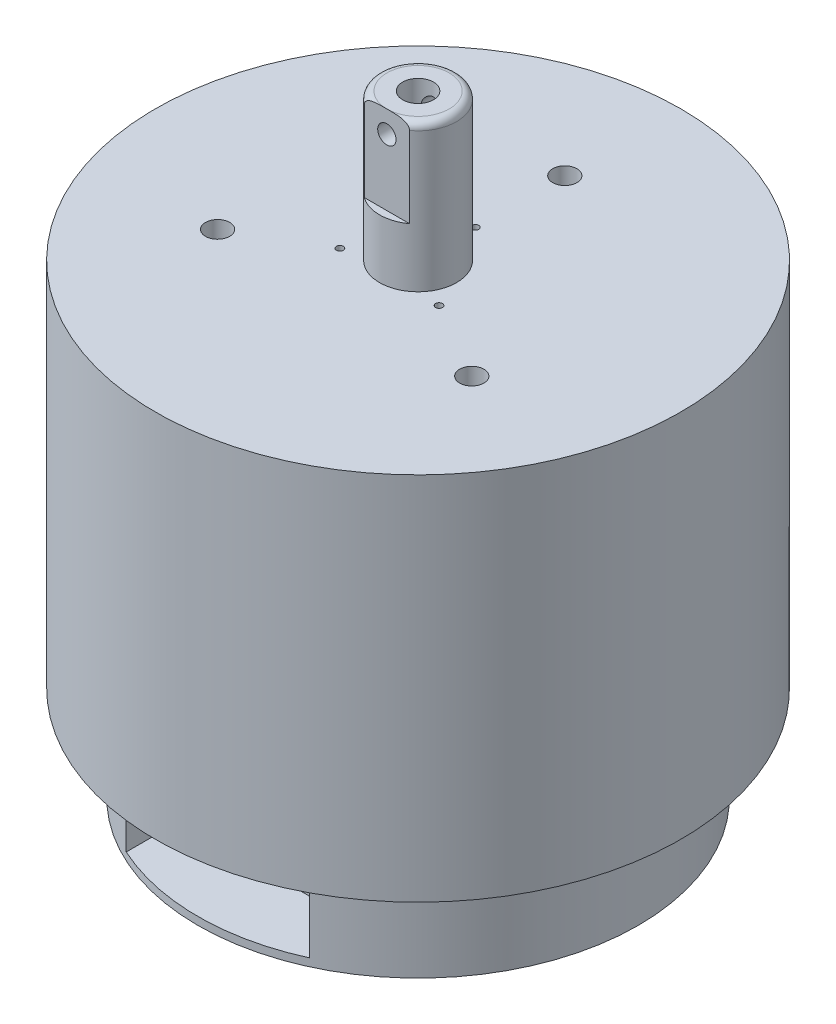
from build123d import *

# Parameters (mm, degrees)
SKETCH_2_R               = 5.25
EXTRUDE_1_DEPTH          = 20
PATTERN_CIRCULAR_1_COUNT = 3
SKETCH_7_W               = 25
SKETCH_7_H               = 12
CUT_EXTRUDE_1_DEPTH      = 20
FILLET_1_R               = 1
SKETCH_9_W               = 7.609655
SKETCH_9_H               = 12
CUT_EXTRUDE_2_DEPTH      = 20
HOLE_WIZARD_M3_1_D       = 2.5
HOLE_WIZARD_M5_1_D       = 4.2
HOLE_WIZARD_M5_1_DEPTH   = 10
HOLE_WIZARD_M5_1_TIP     = 1.2618073


with BuildPart() as part:
    # 草图1 → 旋转1 (revolve)
    with BuildSketch(Plane(origin=(0, 0, 0), x_dir=(0, 0, -1), z_dir=(1, 0, 0)), mode=Mode.PRIVATE) as revolve_1_sk:
        Polygon((0, 0), (-30, 0), (-30, 13.061610641), (-35.8, 13.061610641), (-35.8, 63.5), (0, 63.5), align=None)
    revolve(revolve_1_sk.sketch.rotate(Axis((0, 0, 0), (0, 1, 0)), 180), axis=Axis((0, 0, 0), (0, 1, 0)))

    # 草图2 → 凸台-拉伸1 (add)
    with BuildSketch(Plane(origin=(0, 63.5, 0), x_dir=(1, 0, 0), z_dir=(0, 1, 0))):
        with Locations(Location((0, 0, 0), (0, 0, 90))):
            Circle(SKETCH_2_R)
    extrude(amount=EXTRUDE_1_DEPTH)

    # 草图3 → M4 螺纹孔1 (revolve, cut)
    with BuildSketch(Plane(origin=(0, 63.5, -20), x_dir=(0, 0, 1), z_dir=(1, 0, 0))):
        Polygon((0, 0), (0, 4.991420021), (1.65, 4), (1.65, 0), align=None)
    hole_wizard_m4_1 = revolve(axis=Axis((0, 69.85, -20), (0, -1, 0)), mode=Mode.SUBTRACT)

    # 草图5 → M1.2x0.25 螺纹孔1 (revolve, cut)
    with BuildSketch(Plane(origin=(0, 63.5, -7.8), x_dir=(0, 0, 1), z_dir=(1, 0, 0))):
        Polygon((0, 0), (0, 3.435408794), (0.475, 3.15), (0.475, 0), align=None)
    m1_2x0_25_1 = revolve(axis=Axis((0, 69.85, -7.8), (0, -1, 0)), mode=Mode.SUBTRACT)

    # 阵列(圆周)1: M4 螺纹孔1, M1.2x0.25 螺纹孔1 ×3 about axis
    pattern_circular_1_axis = Axis((0, 0, 0), (0, 1, 0))
    add([hole_wizard_m4_1.rotate(pattern_circular_1_axis, i * 360 / PATTERN_CIRCULAR_1_COUNT) for i in range(1, PATTERN_CIRCULAR_1_COUNT)], mode=Mode.SUBTRACT)
    add([m1_2x0_25_1.rotate(pattern_circular_1_axis, i * 360 / PATTERN_CIRCULAR_1_COUNT) for i in range(1, PATTERN_CIRCULAR_1_COUNT)], mode=Mode.SUBTRACT)

    # 草图7 → 切除-拉伸1 (cut)
    with BuildSketch(Plane.XY.offset(40)):
        with Locations((0, 7.061610641)):
            Rectangle(SKETCH_7_W, SKETCH_7_H)
    extrude(amount=-CUT_EXTRUDE_1_DEPTH, mode=Mode.SUBTRACT)

    # 圆角1
    fillet_1_edges = [part.edges().sort_by_distance(p)[0] for p in [
        (0, 83.5, 5.25),
    ]]
    fillet(fillet_1_edges, radius=FILLET_1_R)

    # 草图9 → 切除-拉伸2 (cut)
    with BuildSketch(Plane.XY.offset(4.25)):
        with Locations((0, 77.5)):
            Rectangle(SKETCH_9_W, SKETCH_9_H)
    extrude(amount=CUT_EXTRUDE_2_DEPTH, mode=Mode.SUBTRACT)

    # M3 螺纹孔1 (through all)
    with Locations(Plane.XY.offset(4.25)):
        with Locations((0, 80.5)):
            Hole(HOLE_WIZARD_M3_1_D / 2)

    # M5 螺纹孔1
    with Locations(Plane(origin=(0, 83.5, 0), x_dir=(1, 0, 0), z_dir=(0, 1, 0))):
        with Locations((0, 0)):
            Hole(HOLE_WIZARD_M5_1_D / 2, depth=HOLE_WIZARD_M5_1_DEPTH)
            with Locations((0, 0, -(HOLE_WIZARD_M5_1_DEPTH + HOLE_WIZARD_M5_1_TIP / 2))):  # 118° drill point
                Cone(0, HOLE_WIZARD_M5_1_D / 2, HOLE_WIZARD_M5_1_TIP, mode=Mode.SUBTRACT)


solid = part.part
